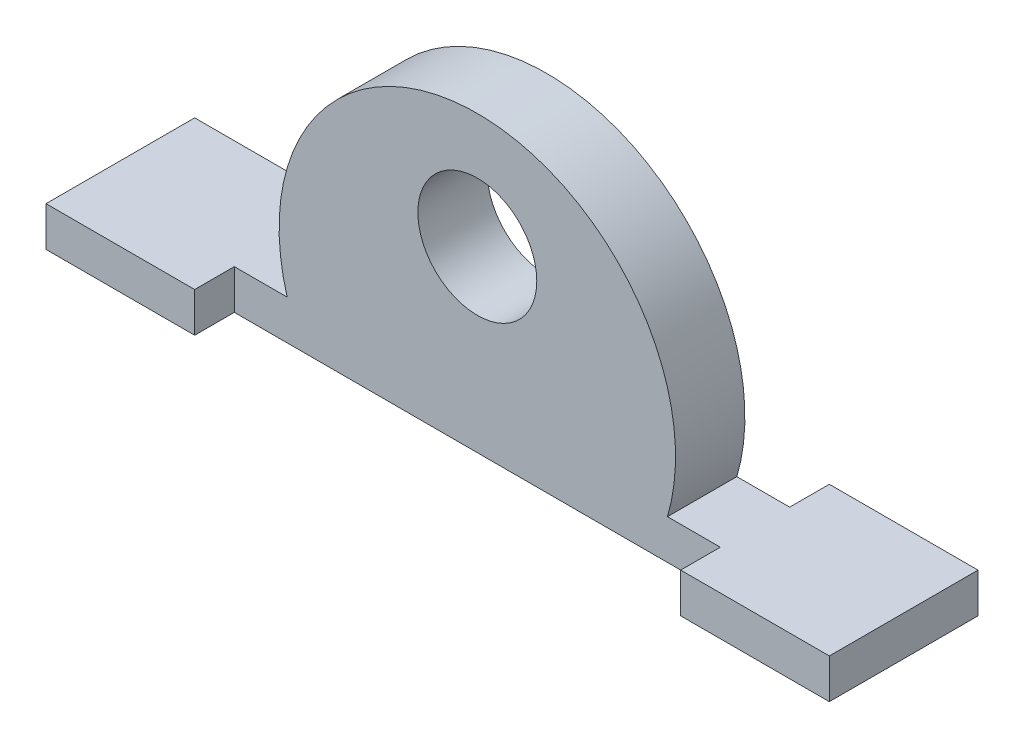
from build123d import *

# Parameters (mm, degrees)
SKETCH1_R           = 6
BOSS_EXTRUDE1_DEPTH = 7
BOSS_EXTRUDE2_DEPTH = 4


with BuildPart() as part:
    # Sketch1 → Boss-Extrude1 (new body)
    with BuildSketch(Plane.XY):
        with BuildLine():
            Line((17.517837099, -9.650149397), (-17.517837099, -9.650149397))
            ThreePointArc((-17.517837099, -9.650149397), (0, 20), (17.517837099, -9.650149397))
        make_face()
        with Locations((0, 8.349850603)):
            Circle(SKETCH1_R, mode=Mode.SUBTRACT)
    extrude(amount=BOSS_EXTRUDE1_DEPTH)

    # Sketch5 → Boss-Extrude2 (add)
    with BuildSketch(Plane.XZ.offset(9.650149397)):
        Polygon((-24.517837099, -4), (-24.517837099, 0), (-17.517837099, 0), (-17.517837099, 7), (-24.517837099, 7), (-24.517837099, 11), (-39.517837099, 11), (-39.517837099, -4), align=None)
        Polygon((24.517837099, -4), (39.517837099, -4), (39.517837099, 11), (24.517837099, 11), (24.517837099, 7), (17.517837099, 7), (17.517837099, 0), (24.517837099, 0), align=None)
    extrude(amount=-BOSS_EXTRUDE2_DEPTH)


solid = part.part
